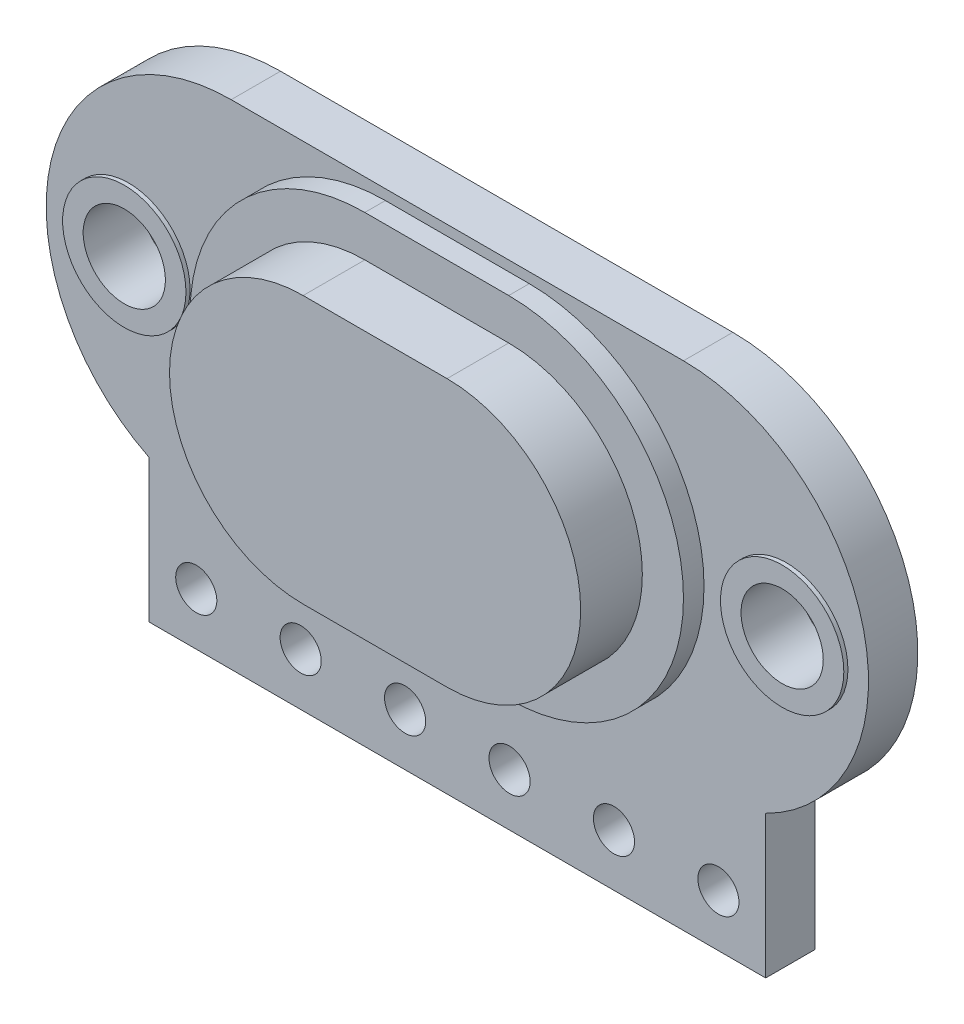
from build123d import *

# Parameters (mm, degrees)
ESQUISSE1_R           = 1
ESQUISSE1_R_2         = 0.5
BOSS_EXTRU_1_DEPTH    = 0.6
BOSS_EXTRU_2_DEPTH    = 0.5
BOSS_EXTRU_4_DEPTH    = 1.5
ESQUISSE3_R           = 1.5
ESQUISSE3_R_2         = 1
ESQUISSE3_R_3         = 0.65
ESQUISSE3_R_4         = 0.5
BOSS_EXTRU_3_DEPTH    = 0.1
CROQUIS1_W            = 0.446175557
CROQUIS1_H            = 1.332309964
CROQUIS1_W_2          = 0.675567057
CROQUIS1_H_2          = 1.353271183
CORTAR_EXTRUIR1_DEPTH = 17


with BuildPart() as part:
    # Esquisse1 → Boss.-Extru.1 (new, symmetric)
    with BuildSketch(Plane.XY):
        with BuildLine():
            Line((-7.5, -4.031128874), (-7.5, -7.5))
            Line((-7.5, -7.5), (7.5, -7.5))
            Line((7.5, -7.5), (7.5, -4.031128874))
            ThreePointArc((7.5, -4.031128874), (9.88121444, 1.027112473), (5.5, 4.5))
            Line((5.5, 4.5), (-5.5, 4.5))
            ThreePointArc((-5.5, 4.5), (-9.88121444, 1.027112473), (-7.5, -4.031128874))
        make_face()
        with Locations((-8, 0)):
            Circle(ESQUISSE1_R, mode=Mode.SUBTRACT)
        with Locations(Location((8, 0, 0), (0, 0, 180))):
            Circle(ESQUISSE1_R, mode=Mode.SUBTRACT)
        with Locations((-6.35, -6.23)):
            Circle(ESQUISSE1_R_2, mode=Mode.SUBTRACT)
        with Locations((-3.81, -6.23)):
            Circle(ESQUISSE1_R_2, mode=Mode.SUBTRACT)
        with Locations((-1.27, -6.23)):
            Circle(ESQUISSE1_R_2, mode=Mode.SUBTRACT)
        with Locations((1.27, -6.23)):
            Circle(ESQUISSE1_R_2, mode=Mode.SUBTRACT)
        with Locations((3.81, -6.23)):
            Circle(ESQUISSE1_R_2, mode=Mode.SUBTRACT)
        with Locations((6.35, -6.23)):
            Circle(ESQUISSE1_R_2, mode=Mode.SUBTRACT)
    extrude(amount=BOSS_EXTRU_1_DEPTH, both=True)

    # Esquisse2 → Boss.-Extru.2 (add)
    with BuildSketch(Plane.XY.offset(0.6)):
        with BuildLine():
            Line((-1.75, 4.25), (1.75, 4.25))
            ThreePointArc((1.75, 4.25), (6, 0), (1.75, -4.25))
            Line((1.75, -4.25), (-1.75, -4.25))
            ThreePointArc((-1.75, -4.25), (-6, 0), (-1.75, 4.25))
        make_face()
    extrude(amount=BOSS_EXTRU_2_DEPTH)

    # Esquisse4 → Boss.-Extru.4 (add)
    with BuildSketch(Plane.XY.offset(1.1)):
        with BuildLine():
            Line((-1.75, -3.25), (1.75, -3.25))
            ThreePointArc((1.75, -3.25), (5, 0), (1.75, 3.25))
            Line((1.75, 3.25), (-1.75, 3.25))
            ThreePointArc((-1.75, 3.25), (-5, 0), (-1.75, -3.25))
        make_face()
    extrude(amount=BOSS_EXTRU_4_DEPTH)

    # Esquisse3 → Boss.-Extru.3 (add)
    # profile 1 of 8: a face of its own
    with BuildSketch(Plane.XY.offset(0.6)):
        with Locations((-8, 0)):
            Circle(ESQUISSE3_R)
        with Locations((-8, 0)):
            Circle(ESQUISSE3_R_2, mode=Mode.SUBTRACT)
    # profile 2 of 8: a face of its own
    with BuildSketch(Plane.XY.offset(0.6)):
        with Locations((8, 0)):
            Circle(ESQUISSE3_R)
        with Locations(Location((8, 0, 0), (0, 0, 180))):
            Circle(ESQUISSE3_R_2, mode=Mode.SUBTRACT)
    # profile 3 of 8: a face of its own
    with BuildSketch(Plane.XY.offset(0.6)):
        with Locations((-6.35, -6.23)):
            Circle(ESQUISSE3_R_3)
        with Locations((-6.35, -6.23)):
            Circle(ESQUISSE3_R_4, mode=Mode.SUBTRACT)
    # profile 4 of 8: a face of its own
    with BuildSketch(Plane.XY.offset(0.6)):
        with Locations((-3.81, -6.23)):
            Circle(ESQUISSE3_R_3)
        with Locations((-3.81, -6.23)):
            Circle(ESQUISSE3_R_4, mode=Mode.SUBTRACT)
    # profile 5 of 8: a face of its own
    with BuildSketch(Plane.XY.offset(0.6)):
        with Locations((-1.27, -6.23)):
            Circle(ESQUISSE3_R_3)
        with Locations((-1.27, -6.23)):
            Circle(ESQUISSE3_R_4, mode=Mode.SUBTRACT)
    # profile 6 of 8: a face of its own
    with BuildSketch(Plane.XY.offset(0.6)):
        with Locations((1.27, -6.23)):
            Circle(ESQUISSE3_R_3)
        with Locations((1.27, -6.23)):
            Circle(ESQUISSE3_R_4, mode=Mode.SUBTRACT)
    # profile 7 of 8: a face of its own
    with BuildSketch(Plane.XY.offset(0.6)):
        with Locations((3.81, -6.23)):
            Circle(ESQUISSE3_R_3)
        with Locations((3.81, -6.23)):
            Circle(ESQUISSE3_R_4, mode=Mode.SUBTRACT)
    # profile 8 of 8: a face of its own
    with BuildSketch(Plane.XY.offset(0.6)):
        with Locations((6.35, -6.23)):
            Circle(ESQUISSE3_R_3)
        with Locations((6.35, -6.23)):
            Circle(ESQUISSE3_R_4, mode=Mode.SUBTRACT)
    boss_extru_3 = extrude(amount=BOSS_EXTRU_3_DEPTH)

    # Symétrie1: Boss.-Extru.3 across plane
    add(boss_extru_3.mirror(Plane.XY))

    # Croquis1 → Cortar-Extruir1 (cut)
    with BuildSketch(Plane(origin=(7.5, 0, 0), x_dir=(0, 0, -1), z_dir=(1, 0, 0))):
        with Locations((0.823087779, -6.23167244)):
            Rectangle(CROQUIS1_W, CROQUIS1_H)
        with Locations((-0.937783529, -6.256635592)):
            Rectangle(CROQUIS1_W_2, CROQUIS1_H_2)
    extrude(amount=-CORTAR_EXTRUIR1_DEPTH, mode=Mode.SUBTRACT)


solid = part.part
